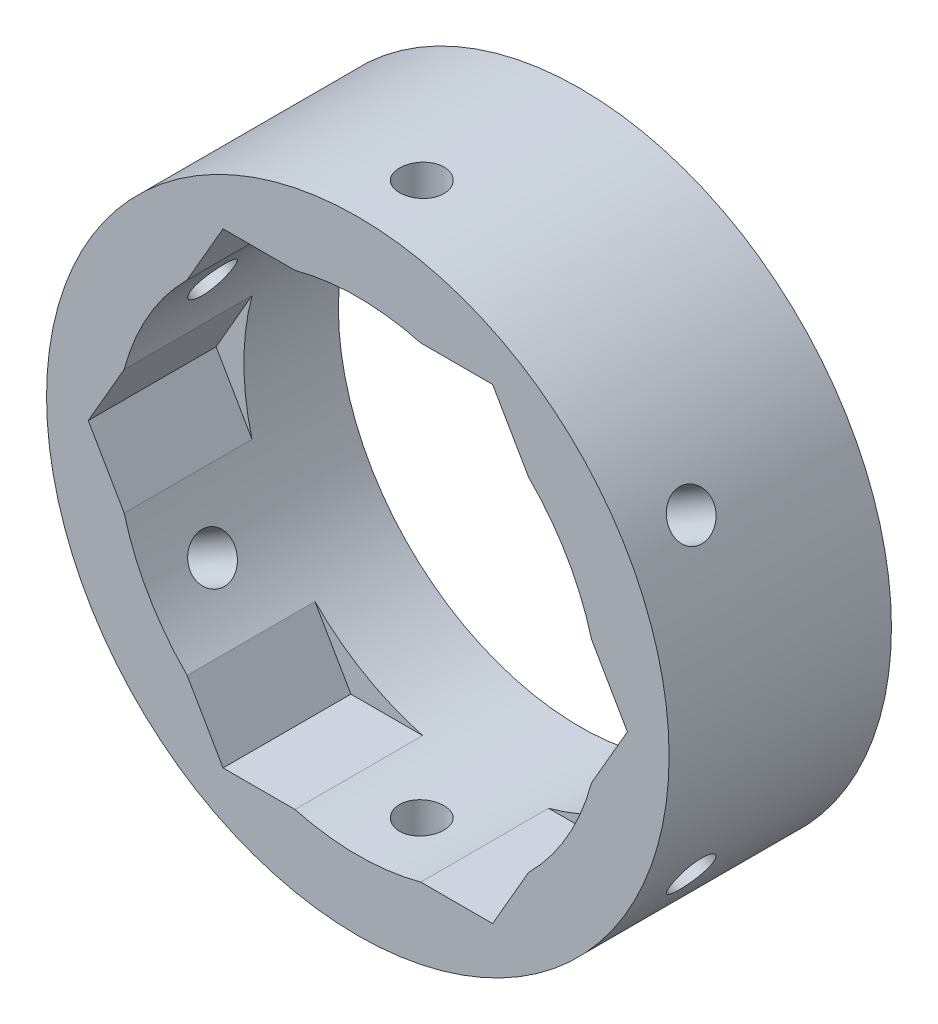
from build123d import *

# Parameters (mm, degrees)
SKETCH1_R               = 14
BOSS_EXTRUDE1_DEPTH     = 10
CUT_EXTRUDE1_REACH      = 24.181
SKETCH2_R               = 10.875
CUT_EXTRUDE2_DEPTH      = 5.75
CUT_EXTRUDE3_REACH      = 31.937
CUT_EXTRUDE3_END_RADIUS = 14
SKETCH4_R               = 1
CUT_EXTRUDE4_REACH      = 33.684
CUT_EXTRUDE4_END_RADIUS = 14
SKETCH5_R               = 1
CUT_EXTRUDE5_REACH      = 33.684
CUT_EXTRUDE5_END_RADIUS = 14
SKETCH6_R               = 1
CUT_EXTRUDE6_REACH      = 31.937
CUT_EXTRUDE6_END_RADIUS = 14
SKETCH7_R               = 1
CUT_EXTRUDE7_REACH      = 33.684
CUT_EXTRUDE7_END_RADIUS = 14
SKETCH8_R               = 1
CUT_EXTRUDE8_REACH      = 33.684
CUT_EXTRUDE8_END_RADIUS = 14
SKETCH9_R               = 1


with BuildPart() as part:
    # Sketch1 → Boss-Extrude1 (new body)
    with BuildSketch(Plane.XY):
        Circle(SKETCH1_R)
    extrude(amount=BOSS_EXTRUDE1_DEPTH)

    # Sketch2 → Cut-Extrude1 (cut, up to next)
    with BuildSketch(Plane.XY.offset(10), mode=Mode.PRIVATE) as cut_extrude1_sk1:
        Circle(SKETCH2_R)
    cut_extrude1_tool1 = extrude(cut_extrude1_sk1.sketch, amount=-CUT_EXTRUDE1_REACH, mode=Mode.PRIVATE) & part.part
    add(cut_extrude1_tool1.solids().sort_by_distance((0, 0, 10))[0], mode=Mode.SUBTRACT)

    # Sketch3 → Cut-Extrude2 (cut)
    with BuildSketch(Plane.XY.offset(10)):
        Polygon((12.124355653, 0), (6.062177826, 10.5), (-6.062177826, 10.5), (-12.124355653, 0), (-6.062177826, -10.5), (6.062177826, -10.5), align=None)
    extrude(amount=-CUT_EXTRUDE2_DEPTH, mode=Mode.SUBTRACT)

    # Cut-Extrude3: up to this cylinder (the profile starts inside it)
    cut_extrude3_end = Plane(origin=(0, 0, 7.125), z_dir=(0, 0, -1)) * Cylinder(CUT_EXTRUDE3_END_RADIUS, 92.874, mode=Mode.PRIVATE)
    # Sketch4 → Cut-Extrude3 (cut, up to the surface)
    with BuildSketch(Plane(origin=(0, 10.5, 0), x_dir=(-1, 0, 0), z_dir=(0, -1, 0)), mode=Mode.PRIVATE) as cut_extrude3_sk1:
        with Locations(Location((0, -7.125, 0), (0, 0, 180))):
            Circle(SKETCH4_R)
    cut_extrude3_tool1 = extrude(cut_extrude3_sk1.sketch, amount=-CUT_EXTRUDE3_REACH, mode=Mode.PRIVATE) & cut_extrude3_end
    add(cut_extrude3_tool1.solids().sort_by_distance((0, 10.5, 7.125))[0], mode=Mode.SUBTRACT)

    # Cut-Extrude4: up to this cylinder (the profile starts inside it)
    cut_extrude4_end = Plane(origin=(0, 0, 7.125), z_dir=(0, 0, -1)) * Cylinder(CUT_EXTRUDE4_END_RADIUS, 96.368, mode=Mode.PRIVATE)
    # Sketch5 → Cut-Extrude4 (cut, up to the surface)
    with BuildSketch(Plane(origin=(9.09326674, 5.25, 0), x_dir=(0, 0, 1), z_dir=(-0.8660254037844386, -0.4999999999999999, 0)), mode=Mode.PRIVATE) as cut_extrude4_sk1:
        with Locations(Location((7.125, 0, 0), (0, 0, 270))):
            Circle(SKETCH5_R)
    cut_extrude4_tool1 = extrude(cut_extrude4_sk1.sketch, amount=-CUT_EXTRUDE4_REACH, mode=Mode.PRIVATE) & cut_extrude4_end
    add(cut_extrude4_tool1.solids().sort_by_distance((9.093267, 5.25, 7.125))[0], mode=Mode.SUBTRACT)

    # Cut-Extrude5: up to this cylinder (the profile starts inside it)
    cut_extrude5_end = Plane(origin=(0, 0, 7.125), z_dir=(0, 0, -1)) * Cylinder(CUT_EXTRUDE5_END_RADIUS, 96.368, mode=Mode.PRIVATE)
    # Sketch6 → Cut-Extrude5 (cut, up to the surface)
    with BuildSketch(Plane(origin=(9.09326674, -5.25, 0), x_dir=(0, 0, 1), z_dir=(-0.8660254037844386, 0.5, 0)), mode=Mode.PRIVATE) as cut_extrude5_sk1:
        with Locations(Location((7.125, 0, 0), (0, 0, 270))):
            Circle(SKETCH6_R)
    cut_extrude5_tool1 = extrude(cut_extrude5_sk1.sketch, amount=-CUT_EXTRUDE5_REACH, mode=Mode.PRIVATE) & cut_extrude5_end
    add(cut_extrude5_tool1.solids().sort_by_distance((9.093267, -5.25, 7.125))[0], mode=Mode.SUBTRACT)

    # Cut-Extrude6: up to this cylinder (the profile starts inside it)
    cut_extrude6_end = Plane(origin=(0, 0, 7.125), z_dir=(0, 0, -1)) * Cylinder(CUT_EXTRUDE6_END_RADIUS, 92.874, mode=Mode.PRIVATE)
    # Sketch7 → Cut-Extrude6 (cut, up to the surface)
    with BuildSketch(Plane(origin=(0, -10.5, 0), x_dir=(1, 0, 0), z_dir=(0, 1, 0)), mode=Mode.PRIVATE) as cut_extrude6_sk1:
        with Locations((0, -7.125)):
            Circle(SKETCH7_R)
    cut_extrude6_tool1 = extrude(cut_extrude6_sk1.sketch, amount=-CUT_EXTRUDE6_REACH, mode=Mode.PRIVATE) & cut_extrude6_end
    add(cut_extrude6_tool1.solids().sort_by_distance((0, -10.5, 7.125))[0], mode=Mode.SUBTRACT)

    # Cut-Extrude7: up to this cylinder (the profile starts inside it)
    cut_extrude7_end = Plane(origin=(0, 0, 7.125), z_dir=(0, 0, -1)) * Cylinder(CUT_EXTRUDE7_END_RADIUS, 96.368, mode=Mode.PRIVATE)
    # Sketch8 → Cut-Extrude7 (cut, up to the surface)
    with BuildSketch(Plane(origin=(-9.09326674, -5.25, 0), x_dir=(0, 0, -1), z_dir=(0.8660254037844385, 0.5000000000000003, 0)), mode=Mode.PRIVATE) as cut_extrude7_sk1:
        with Locations(Location((-7.125, 0, 0), (0, 0, 270))):
            Circle(SKETCH8_R)
    cut_extrude7_tool1 = extrude(cut_extrude7_sk1.sketch, amount=-CUT_EXTRUDE7_REACH, mode=Mode.PRIVATE) & cut_extrude7_end
    add(cut_extrude7_tool1.solids().sort_by_distance((-9.093267, -5.25, 7.125))[0], mode=Mode.SUBTRACT)

    # Cut-Extrude8: up to this cylinder (the profile starts inside it)
    cut_extrude8_end = Plane(origin=(0, 0, 7.125), z_dir=(0, 0, -1)) * Cylinder(CUT_EXTRUDE8_END_RADIUS, 96.368, mode=Mode.PRIVATE)
    # Sketch9 → Cut-Extrude8 (cut, up to the surface)
    with BuildSketch(Plane(origin=(-9.09326674, 5.25, 0), x_dir=(0, 0, -1), z_dir=(0.8660254037844388, -0.49999999999999983, 0)), mode=Mode.PRIVATE) as cut_extrude8_sk1:
        with Locations(Location((-7.125, 0, 0), (0, 0, 270))):
            Circle(SKETCH9_R)
    cut_extrude8_tool1 = extrude(cut_extrude8_sk1.sketch, amount=-CUT_EXTRUDE8_REACH, mode=Mode.PRIVATE) & cut_extrude8_end
    add(cut_extrude8_tool1.solids().sort_by_distance((-9.093267, 5.25, 7.125))[0], mode=Mode.SUBTRACT)


solid = part.part
